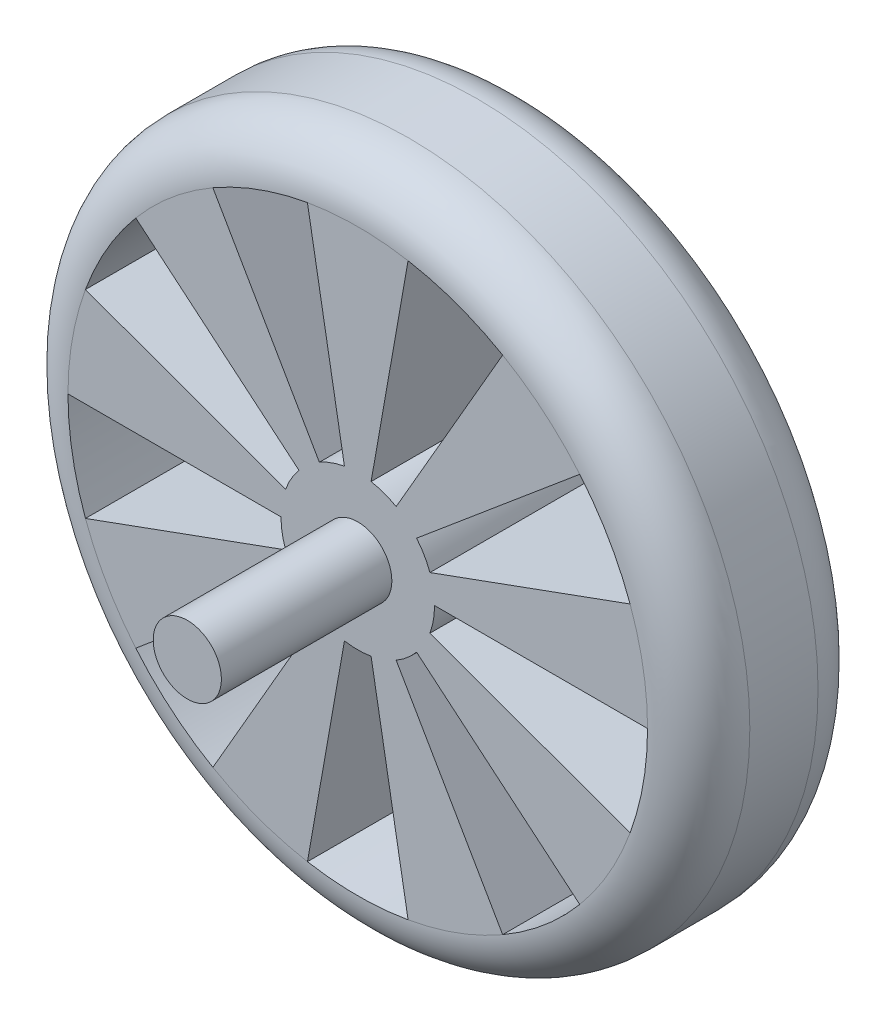
from build123d import *

# Parameters (mm, degrees)
SKETCH_1_R          = 100
EXTRUDE_1_DEPTH     = 50
SKETCH_2_R          = 10
EXTRUDE_2_DEPTH     = 50
FILLET_1_R          = 15
CUT_EXTRUDE_1_DEPTH = 151.000000067


with BuildPart() as part:
    # 草图1 → 凸台-拉伸1 (new body)
    with BuildSketch(Plane.XY):
        Circle(SKETCH_1_R)
    extrude(amount=EXTRUDE_1_DEPTH)

    # 草图2 → 凸台-拉伸2 (add)
    with BuildSketch(Plane.XY.offset(50)):
        Circle(SKETCH_2_R)
    extrude(amount=EXTRUDE_2_DEPTH)

    # 圆角1
    fillet_1_edges = [part.edges().sort_by_distance(p)[0] for p in [
        (-100, 0, 0),
        (-100, 0, 50),
    ]]
    fillet(fillet_1_edges, radius=FILLET_1_R)

    # 草图3 → 切除-拉伸1 (cut, through all)
    with BuildSketch(Plane.XY.offset(50)):
        with BuildLine():
            ThreePointArc((-11.262655322, 19.507491245), (-7.704109975, 21.166868192), (-3.911479145, 22.18310056))
            Line((-3.911479145, 22.18310056), (-14.760095102, 83.708659006))
            ThreePointArc((-14.760095102, 83.708659006), (-29.071712183, 79.873872767), (-42.5, 73.612159322))
            Line((-42.5, 73.612159322), (-11.262655322, 19.507491245))
        make_face()
        with BuildLine():
            Line((14.760095102, 83.708659006), (3.911479145, 22.18310056))
            ThreePointArc((3.911479145, 22.18310056), (7.704109975, 21.166868192), (11.262655322, 19.507491245))
            Line((11.262655322, 19.507491245), (42.5, 73.612159322))
            ThreePointArc((42.5, 73.612159322), (29.071712183, 79.873872767), (14.760095102, 83.708659006))
        make_face()
        with BuildLine():
            Line((65.113777665, 54.636946823), (17.255389048, 14.478990586))
            ThreePointArc((17.255389048, 14.478990586), (19.507491245, 11.262655322), (21.166868192, 7.704109975))
            Line((21.166868192, 7.704109975), (79.873872767, 29.071712183))
            ThreePointArc((79.873872767, 29.071712183), (73.612159322, 42.5), (65.113777665, 54.636946823))
        make_face()
        with BuildLine():
            Line((85, 0), (22.525310643, 0))
            ThreePointArc((22.525310643, 0), (22.18310056, -3.911479145), (21.166868192, -7.704109975))
            Line((21.166868192, -7.704109975), (79.873872767, -29.071712183))
            ThreePointArc((79.873872767, -29.071712183), (83.708659006, -14.760095102), (85, 0))
        make_face()
        with BuildLine():
            Line((65.113777665, -54.636946823), (17.255389048, -14.478990586))
            ThreePointArc((17.255389048, -14.478990586), (14.478990586, -17.255389048), (11.262655322, -19.507491245))
            Line((11.262655322, -19.507491245), (42.5, -73.612159322))
            ThreePointArc((42.5, -73.612159322), (54.636946823, -65.113777665), (65.113777665, -54.636946823))
        make_face()
        with BuildLine():
            Line((14.760095102, -83.708659006), (3.911479145, -22.18310056))
            ThreePointArc((3.911479145, -22.18310056), (0, -22.525310643), (-3.911479145, -22.18310056))
            Line((-3.911479145, -22.18310056), (-14.760095102, -83.708659006))
            ThreePointArc((-14.760095102, -83.708659006), (0, -85), (14.760095102, -83.708659006))
        make_face()
        with BuildLine():
            Line((-42.5, -73.612159322), (-11.262655322, -19.507491245))
            ThreePointArc((-11.262655322, -19.507491245), (-14.478990586, -17.255389048), (-17.255389048, -14.478990586))
            Line((-17.255389048, -14.478990586), (-65.113777665, -54.636946823))
            ThreePointArc((-65.113777665, -54.636946823), (-54.636946823, -65.113777665), (-42.5, -73.612159322))
        make_face()
        with BuildLine():
            Line((-79.873872767, -29.071712183), (-21.166868192, -7.704109975))
            ThreePointArc((-21.166868192, -7.704109975), (-22.18310056, -3.911479145), (-22.525310643, 0))
            Line((-22.525310643, 0), (-85, 0))
            ThreePointArc((-85, 0), (-83.708659006, -14.760095102), (-79.873872767, -29.071712183))
        make_face()
        with BuildLine():
            Line((-79.873872767, 29.071712183), (-21.166868192, 7.704109975))
            ThreePointArc((-21.166868192, 7.704109975), (-19.507491245, 11.262655322), (-17.255389048, 14.478990586))
            Line((-17.255389048, 14.478990586), (-65.113777665, 54.636946823))
            ThreePointArc((-65.113777665, 54.636946823), (-73.612159322, 42.5), (-79.873872767, 29.071712183))
        make_face()
    extrude(amount=-CUT_EXTRUDE_1_DEPTH, mode=Mode.SUBTRACT)


solid = part.part
